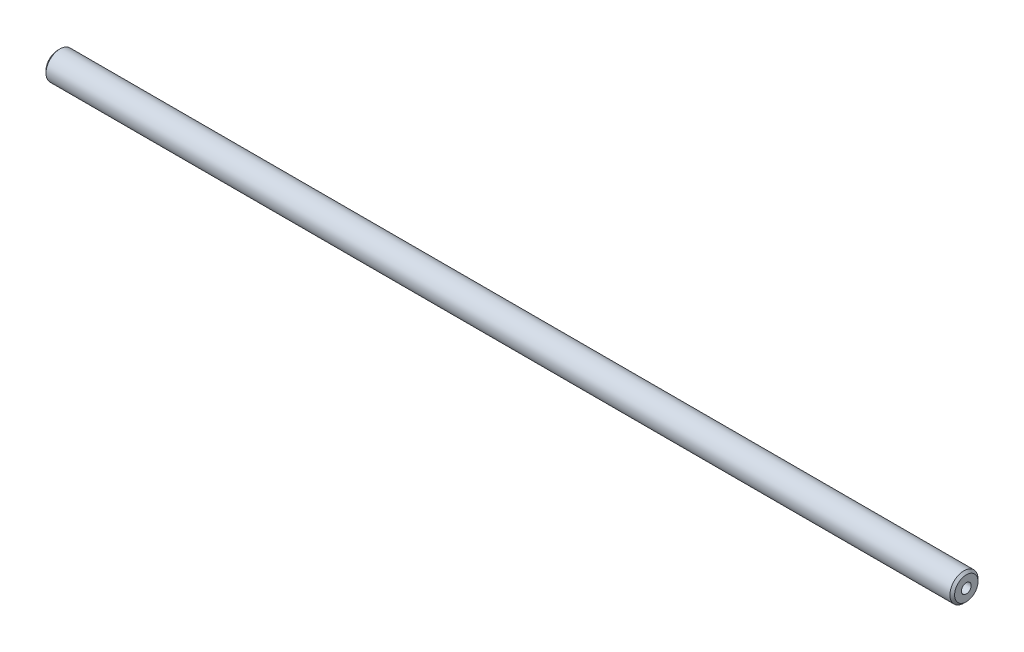
from build123d import *

# Parameters (mm, degrees)
SKETCH1_R             = 6
BOSS_EXTRUDE1_DEPTH   = 388
CHAMFER1_SIZE         = 1
M5_TAPPED_HOLE1_D     = 4.2
M5_TAPPED_HOLE1_DEPTH = 14
M5_TAPPED_HOLE1_TIP   = 1.2618073
M5_TAPPED_HOLE2_D     = 4.2
M5_TAPPED_HOLE2_DEPTH = 14
M5_TAPPED_HOLE2_TIP   = 1.2618073


with BuildPart() as part:
    # Sketch1 → Boss-Extrude1 (new body)
    with BuildSketch(Plane(origin=(0, 0, 0), x_dir=(0, 0, -1), z_dir=(1, 0, 0))):
        with Locations(Location((0, 0, 0), (0, 0, 180))):
            Circle(SKETCH1_R)
    extrude(amount=BOSS_EXTRUDE1_DEPTH)

    # Chamfer1
    chamfer1_edges = [part.edges().sort_by_distance(p)[0] for p in [
        (0, 0, -6),
        (388, 0, -6),
    ]]
    chamfer(chamfer1_edges, length=CHAMFER1_SIZE)

    # M5 Tapped Hole1
    with Locations(Plane(origin=(388, 0, 0), x_dir=(0, 0, -1), z_dir=(1, 0, 0))):
        with Locations((0, 0)):
            Hole(M5_TAPPED_HOLE1_D / 2, depth=M5_TAPPED_HOLE1_DEPTH)
            with Locations((0, 0, -(M5_TAPPED_HOLE1_DEPTH + M5_TAPPED_HOLE1_TIP / 2))):  # 118° drill point
                Cone(0, M5_TAPPED_HOLE1_D / 2, M5_TAPPED_HOLE1_TIP, mode=Mode.SUBTRACT)

    # M5 Tapped Hole2
    with Locations(Plane.ZY):
        with Locations((0, 0)):
            Hole(M5_TAPPED_HOLE2_D / 2, depth=M5_TAPPED_HOLE2_DEPTH)
            with Locations((0, 0, -(M5_TAPPED_HOLE2_DEPTH + M5_TAPPED_HOLE2_TIP / 2))):  # 118° drill point
                Cone(0, M5_TAPPED_HOLE2_D / 2, M5_TAPPED_HOLE2_TIP, mode=Mode.SUBTRACT)


solid = part.part
